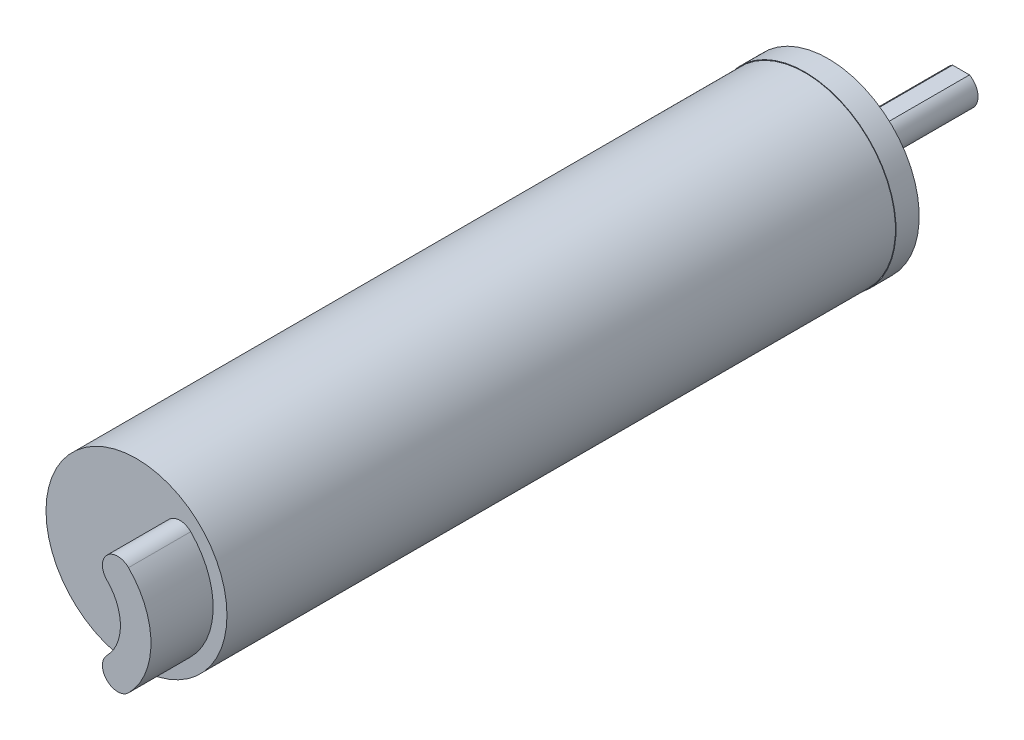
from build123d import *
from build123d.topology import SkipClean

# Parameters (mm, degrees)
SKETCH_1_R             = 8
EXTRUDE_1_DEPTH        = 61.1
EXTRUDE_2_DEPTH        = 11.8
SKETCH_3_R             = 3
EXTRUDE_3_DEPTH        = 1
SKETCH_4_R             = 2.75
EXTRUDE_4_DEPTH        = 1.6
EXTRUDE_5_DEPTH        = 0.05
EXTRUDE_5_DEPTH_BACK   = 2
SKETCH_5_R             = 8.05
HOLE_WIZARD_M2_1_D     = 1.6
HOLE_WIZARD_M2_1_DEPTH = 5.2
HOLE_WIZARD_M2_1_TIP   = 0.480688495
CHAMFER_1_SIZE         = 0.25
SKETCH1_R              = 1.5
EXTRUDE1_DEPTH         = 1.4
EXTRUDE2_DEPTH         = 5.5


with BuildPart() as part:
    # 草图1 → 拉伸1 (new body)
    with BuildSketch(Plane.XY):
        Circle(SKETCH_1_R)
    extrude(amount=EXTRUDE_1_DEPTH)

    # 草图2 → 拉伸2 (add)
    with BuildSketch(Plane(origin=(0, 0, 0), x_dir=(-1, 0, 0), z_dir=(0, 0, -1))):
        with BuildLine():
            Line((-0.748331477, 1.3), (0.748331477, 1.3))
            ThreePointArc((0.748331477, 1.3), (0, -1.5), (-0.748331477, 1.3))
        make_face()
    extrude(amount=EXTRUDE_2_DEPTH)

    # 草图3 → 拉伸3 (add)
    with BuildSketch(Plane(origin=(0, 0, 0), x_dir=(-1, 0, 0), z_dir=(0, 0, -1))):
        with Locations(Location((0, 0, 0), (0, 0, 180))):
            Circle(SKETCH_3_R)
    extrude(amount=EXTRUDE_3_DEPTH)

    # 草图4 → 拉伸4 (add)
    with BuildSketch(Plane(origin=(0, 0, -1), x_dir=(-1, 0, 0), z_dir=(0, 0, -1))):
        Circle(SKETCH_4_R)
    extrude(amount=EXTRUDE_4_DEPTH)

    # 草图5 → 拉伸5 (add, two sides: drawn at the far end of the back side and taken through both)
    with BuildSketch(Plane(origin=(0, 0, 0), x_dir=(-1, 0, 0), z_dir=(0, 0, -1)).offset(-EXTRUDE_5_DEPTH_BACK)):
        Circle(SKETCH_5_R)
    extrude(amount=EXTRUDE_5_DEPTH + EXTRUDE_5_DEPTH_BACK)

    # M2 螺纹孔1
    with Locations(Plane(origin=(5, 0, -0.05), x_dir=(-1, 0, 0), z_dir=(0, 0, -1))):
        with Locations((0, 0), (10, 0)):
            Hole(HOLE_WIZARD_M2_1_D / 2, depth=HOLE_WIZARD_M2_1_DEPTH)
            with Locations((0, 0, -(HOLE_WIZARD_M2_1_DEPTH + HOLE_WIZARD_M2_1_TIP / 2))):  # 118° drill point
                Cone(0, HOLE_WIZARD_M2_1_D / 2, HOLE_WIZARD_M2_1_TIP, mode=Mode.SUBTRACT)

    # 倒角1
    chamfer_1_edges = [part.edges().sort_by_distance(p)[0] for p in [
        (-5.8, 0, -0.05),
        (4.2, 0, -0.05),
    ]]
    chamfer(chamfer_1_edges, length=CHAMFER_1_SIZE)

    # Sketch1 → Extrude1 (add)
    with SkipClean():  # the faces are left unmerged after this step: merging them gives an invalid solid
        with BuildSketch(Plane(origin=(0, 0, -2.6), x_dir=(-1, 0, 0), z_dir=(0, 0, -1))):
            with Locations(Location((0, 0, 0), (0, 0, 119.926434867))):
                Circle(SKETCH1_R)
        extrude(amount=EXTRUDE1_DEPTH)

    # Sketch2 → Extrude2 (add)
    with SkipClean():  # the faces are left unmerged after this step: merging them gives an invalid solid
        with BuildSketch(Plane.XY.offset(61.1)):
            with BuildLine():
                ThreePointArc((4.793495579, -4.793495579), (6.779026459, 0), (4.793495579, 4.793495579))
                ThreePointArc((4.793495579, 4.793495579), (2.88430727, 4.793495579), (2.88430727, 2.88430727))
                ThreePointArc((2.88430727, 2.88430727), (4.079026459, 0), (2.88430727, -2.88430727))
                ThreePointArc((2.88430727, -2.88430727), (2.88430727, -4.793495579), (4.793495579, -4.793495579))
            make_face()
        extrude(amount=EXTRUDE2_DEPTH)


solid = part.part
